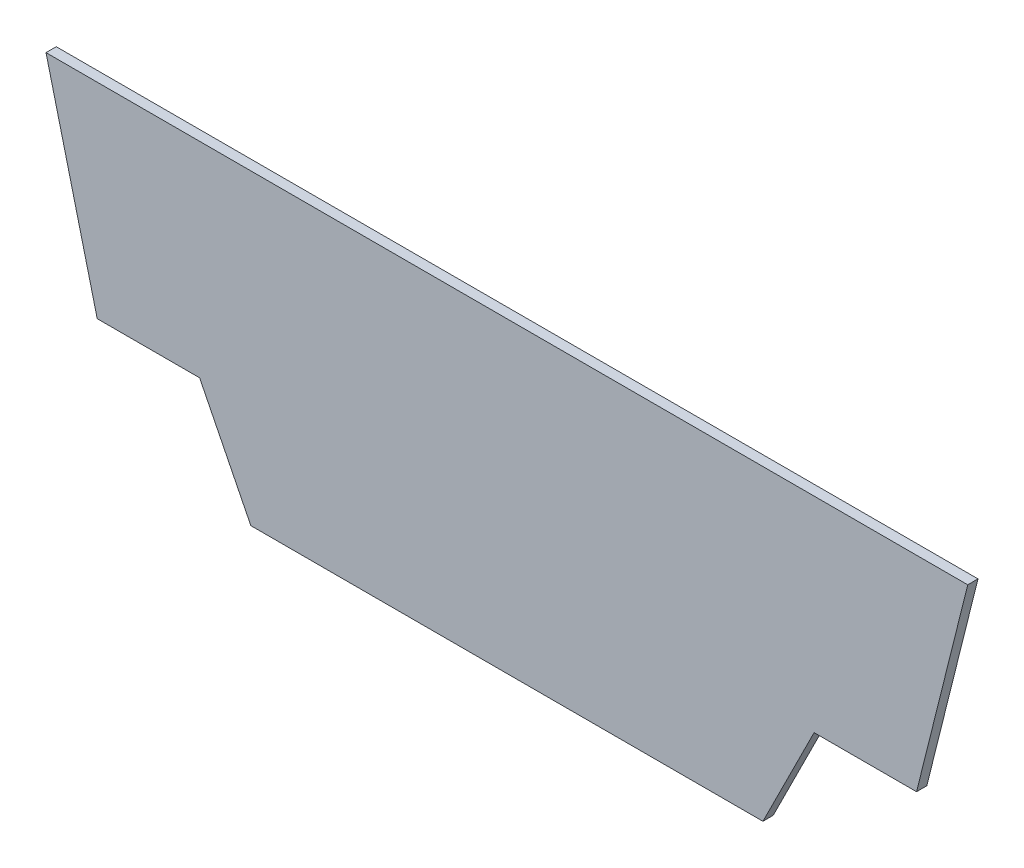
from build123d import *

# Parameters (mm, degrees)
EXTRUDE_1_DEPTH = 2


with BuildPart() as part:
    # 草图2 → 凸台-拉伸1 (new body)
    with BuildSketch(Plane.XY):
        Polygon((-90, 60), (90, 60), (80, 20), (60, 20), (50, 0), (-50, 0), (-60, 20), (-80, 20), align=None)
    extrude(amount=EXTRUDE_1_DEPTH)


solid = part.part
